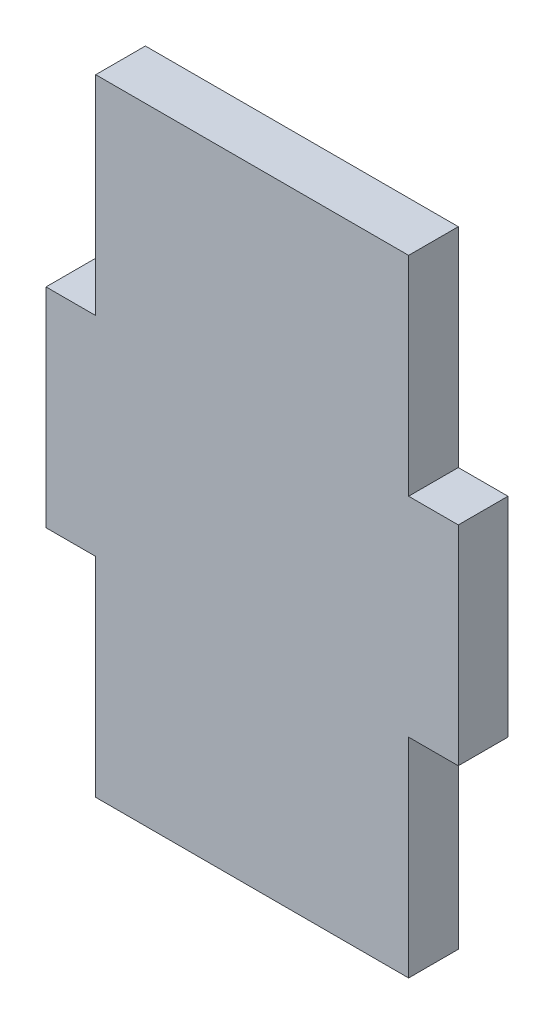
from build123d import *

# Parameters (mm, degrees)
BOSS_EXTRUDE1_DEPTH = 3.175


with BuildPart() as part:
    # Sketch1 → Boss-Extrude1 (new body)
    with BuildSketch(Plane.XY):
        Polygon((0, 26.666666667), (-3.175, 26.666666667), (-3.175, 13.333333333), (0, 13.333333333), (0, 0), (20, 0), (20, 13.333333333), (23.175, 13.333333333), (23.175, 26.666666667), (20, 26.666666667), (20, 40), (0, 40), align=None)
    extrude(amount=BOSS_EXTRUDE1_DEPTH)


solid = part.part
